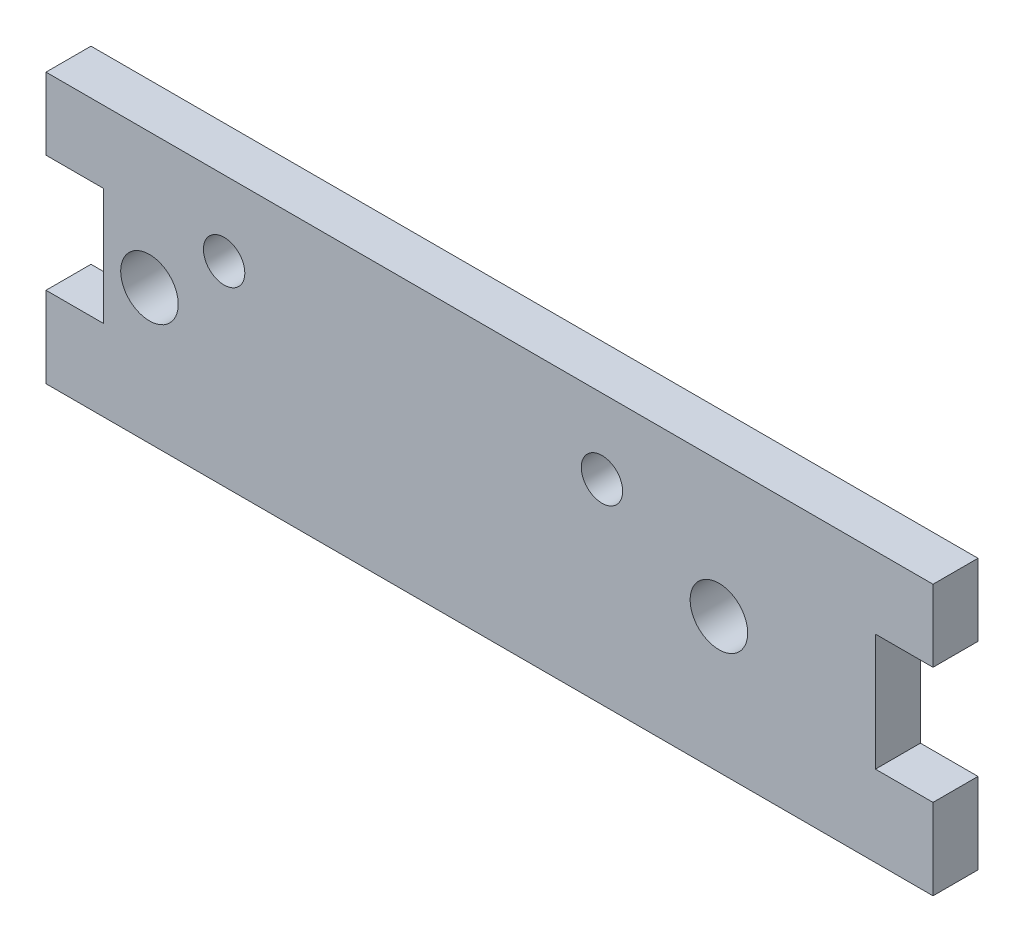
from build123d import *

# Parameters (mm, degrees)
SKETCH_1_W          = 49.3
SKETCH_1_H          = 15
EXTRUDE_1_DEPTH     = 2.5
SKETCH_2_R          = 1.6
CUT_EXTRUDE_1_DEPTH = 52.592053652
SKETCH_3_W          = 3.2
SKETCH_3_H          = 6.5
CUT_EXTRUDE_2_DEPTH = 10
SKETCH_4_R          = 1.15
CUT_EXTRUDE_3_DEPTH = 10


with BuildPart() as part:
    # 草图1 → 凸台-拉伸1 (new body)
    with BuildSketch(Plane.XY):
        with Locations((24.65, 7.5)):
            Rectangle(SKETCH_1_W, SKETCH_1_H)
    extrude(amount=EXTRUDE_1_DEPTH)

    # 草图2 → 切除-拉伸1 (cut, through all)
    with BuildSketch(Plane(origin=(0, 0, 0), x_dir=(-1, 0, 0), z_dir=(0, 0, -1))):
        with Locations((-5.75, 7.5)):
            Circle(SKETCH_2_R)
        with Locations((-37.4, 7.5)):
            Circle(SKETCH_2_R)
    extrude(amount=-CUT_EXTRUDE_1_DEPTH, mode=Mode.SUBTRACT)

    # 草图3 → 切除-拉伸2 (cut)
    with BuildSketch(Plane.XY.offset(2.5)):
        with Locations((1.6, 7.75)):
            Rectangle(SKETCH_3_W, SKETCH_3_H)
    cut_extrude_2 = extrude(amount=-CUT_EXTRUDE_2_DEPTH, mode=Mode.SUBTRACT)

    # 镜向1: 切除-拉伸2 across plane
    add(cut_extrude_2.mirror(Plane.ZY.offset(-24.65)), mode=Mode.SUBTRACT)

    # 草图4 → 切除-拉伸3 (cut)
    with BuildSketch(Plane.XY.offset(2.5)):
        with Locations((9.9, 10.85)):
            Circle(SKETCH_4_R)
        with Locations((30.9, 10.85)):
            Circle(SKETCH_4_R)
    extrude(amount=-CUT_EXTRUDE_3_DEPTH, mode=Mode.SUBTRACT)


solid = part.part
